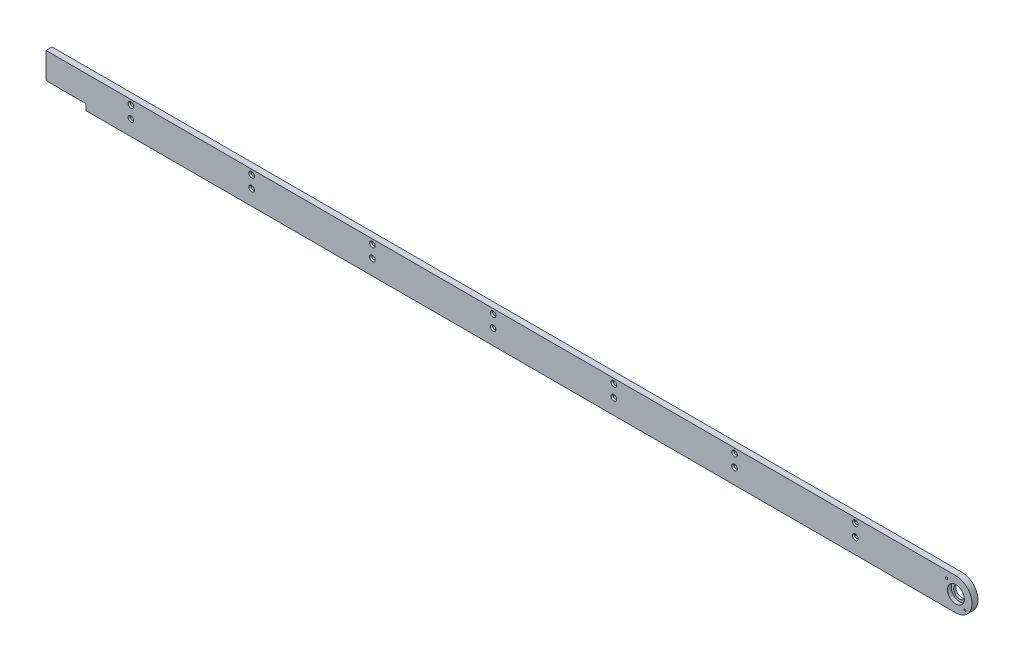
from build123d import *

# Parameters (mm, degrees)
ESTRUSIONE1_DEPTH                    = 15
SCHIZZO2_R                           = 4
SCHIZZO2_R_2                         = 15
TAGLIO_ESTRUSIONE1_DEPTH             = 15
SCHIZZO4_R                           = 6.75
TAGLIO_ESTRUSIONE3_DEPTH             = 8.5
SCHIZZO5_R                           = 4
TAGLIO_ESTRUSIONE4_DEPTH             = 30
SMUSSO1_SIZE                         = 3
TAGLIO_ESTRUSIONE8_START             = -30
TAGLIO_ESTRUSIONE8_DEPTH             = 30
SCHIZZO12_R                          = 4
TAGLIO_ESTRUSIONE9_DEPTH             = 30
SCHIZZO13_R                          = 21
TAGLIO_ESTRUSIONE10_DEPTH            = 9.5
RIPETIZIONE_A_L1_COUNT               = 4
RIPETIZIONE_A_L1_PITCH               = 300
SMUSSO1_OF_RIPETIZIONE_A_L1_SIZE     = 3
RIPETIZIONE_A_L1_COL_COUNT           = 4
RIPETIZIONE_A_L1_COL_PITCH           = 300
SMUSSO1_OF_RIPETIZIONE_A_L1_COL_SIZE = 3
FORO_FILETTATO_M6_1_D                = 5


with BuildPart() as part:
    # Schizzo1 → Estrusione1 (new body)
    with BuildSketch(Plane.XY):
        with BuildLine():
            Line((-1150, 40), (1150, 40))
            ThreePointArc((1150, 40), (1190, 0), (1150, -40))
            Line((1150, -40), (-1150, -40))
            ThreePointArc((-1150, -40), (-1190, 0), (-1150, 40))
        make_face()
    extrude(amount=ESTRUSIONE1_DEPTH)

    # Schizzo2 → Taglio-Estrusione1 (cut)
    with BuildSketch(Plane.XY.offset(15)):
        with Locations((-1150, 0)):
            Circle(SCHIZZO2_R)
        with Locations(Location((1150, 0, 0), (0, 0, 180))):
            Circle(SCHIZZO2_R_2)
    extrude(amount=-TAGLIO_ESTRUSIONE1_DEPTH, mode=Mode.SUBTRACT)

    # Schizzo4 → Taglio-Estrusione3 (cut)
    with BuildSketch(Plane.XY.offset(15)):
        with Locations((-1150, 0)):
            Circle(SCHIZZO4_R)
    extrude(amount=-TAGLIO_ESTRUSIONE3_DEPTH, mode=Mode.SUBTRACT)

    # Schizzo5 → Taglio-Estrusione4 (cut)
    with BuildSketch(Plane.XY.offset(15)):
        with Locations((0, -2)):
            Circle(SCHIZZO5_R)
        with Locations((0, 28)):
            Circle(SCHIZZO5_R)
    taglio_estrusione4 = extrude(amount=-TAGLIO_ESTRUSIONE4_DEPTH, mode=Mode.SUBTRACT)

    # Smusso1
    smusso1_edges = [part.edges().sort_by_distance(p)[0] for p in [
        (-4, -2, 15),
        (-4, 28, 15),
    ]]
    chamfer(smusso1_edges, length=SMUSSO1_SIZE)

    # Schizzo11 → Taglio-Estrusione8 (cut)
    with BuildSketch(Plane.XY.offset(15).offset(TAGLIO_ESTRUSIONE8_START)):
        with BuildLine():
            Line((-1150, 40), (-1111, 40))
            Line((-1111, 40), (-1111, -20))
            ThreePointArc((-1111, -20), (-1109.535533906, -23.535533906), (-1106, -25))
            Line((-1106, -25), (-1016, -25))
            ThreePointArc((-1016, -25), (-1012.464466094, -26.464466094), (-1011, -30))
            Line((-1011, -30), (-1011, -40))
            Line((-1011, -40), (-1150, -40))
            ThreePointArc((-1150, -40), (-1190, 0), (-1150, 40))
        make_face()
    extrude(amount=TAGLIO_ESTRUSIONE8_DEPTH, mode=Mode.SUBTRACT)

    # Schizzo12 → Taglio-Estrusione9 (cut)
    with BuildSketch(Plane.XZ.offset(25)):
        with Locations(Location((-1095, 7.5, 0), (0, 0, 270))):
            Circle(SCHIZZO12_R)
        with Locations(Location((-1045, 7.5, 0), (0, 0, 270))):
            Circle(SCHIZZO12_R)
    extrude(amount=-TAGLIO_ESTRUSIONE9_DEPTH, mode=Mode.SUBTRACT)

    # Schizzo13 → Taglio-Estrusione10 (cut)
    with BuildSketch(Plane.XY.offset(15)):
        with Locations((1150, 0)):
            Circle(SCHIZZO13_R)
    extrude(amount=-TAGLIO_ESTRUSIONE10_DEPTH, mode=Mode.SUBTRACT)

    # Ripetizione a L1: Taglio-Estrusione4 ×4
    with Locations(*[(-i * RIPETIZIONE_A_L1_PITCH, 0, 0) for i in range(1, RIPETIZIONE_A_L1_COUNT)]):
        add(taglio_estrusione4, mode=Mode.SUBTRACT)

    # Smusso1 of Ripetizione a L1
    smusso1_of_ripetizione_a_l1_edges = [part.edges().sort_by_distance(p)[0] for p in [
        (-304, -2, 15),
        (-304, 28, 15),
        (-604, -2, 15),
        (-604, 28, 15),
        (-904, -2, 15),
        (-904, 28, 15),
    ]]
    chamfer(smusso1_of_ripetizione_a_l1_edges, length=SMUSSO1_OF_RIPETIZIONE_A_L1_SIZE)

    # Ripetizione a L1 col: Taglio-Estrusione4 ×4
    with Locations(*[(i * RIPETIZIONE_A_L1_COL_PITCH, 0, 0) for i in range(1, RIPETIZIONE_A_L1_COL_COUNT)]):
        add(taglio_estrusione4, mode=Mode.SUBTRACT)

    # Smusso1 of Ripetizione a L1 col
    smusso1_of_ripetizione_a_l1_col_edges = [part.edges().sort_by_distance(p)[0] for p in [
        (296, -2, 15),
        (296, 28, 15),
        (596, -2, 15),
        (596, 28, 15),
        (896, -2, 15),
        (896, 28, 15),
    ]]
    chamfer(smusso1_of_ripetizione_a_l1_col_edges, length=SMUSSO1_OF_RIPETIZIONE_A_L1_COL_SIZE)

    # Foro filettato M6-1 (through all)
    with Locations(Plane.XY.offset(15)):
        with Locations((1127.019029611, 22.980970389), (1172.980970389, -22.980970389)):
            Hole(FORO_FILETTATO_M6_1_D / 2)


solid = part.part
